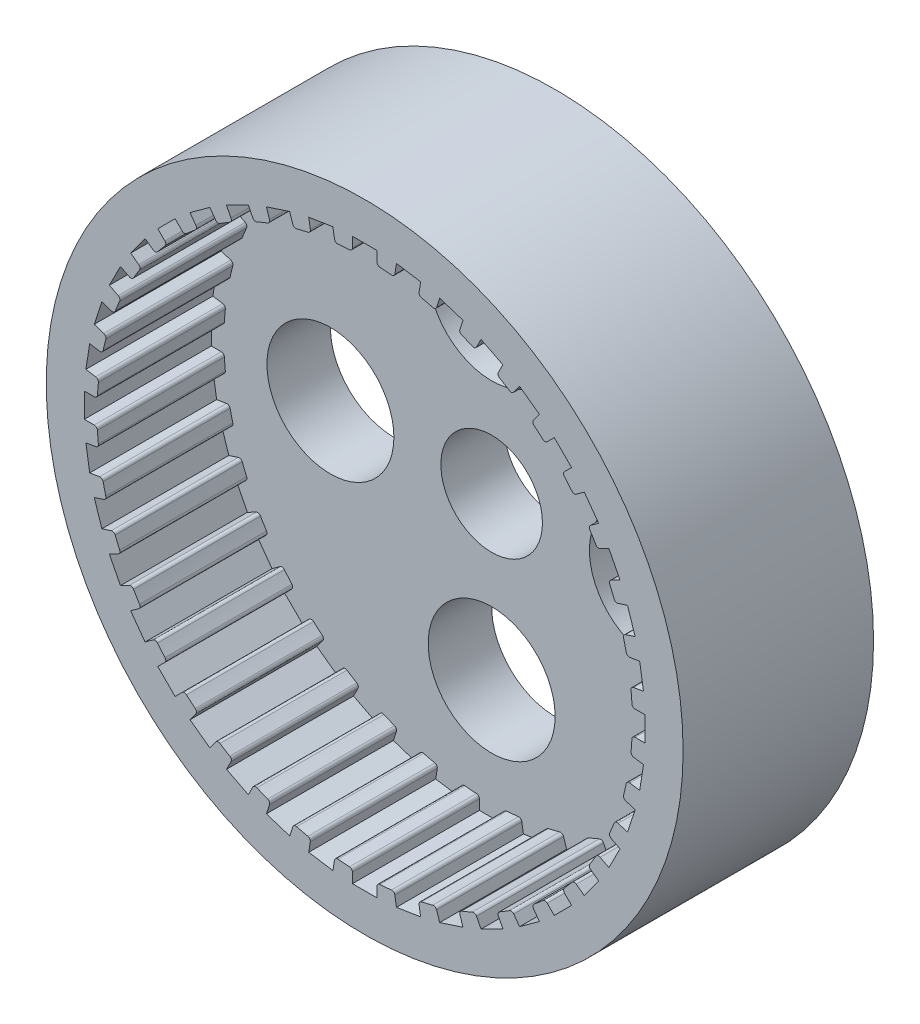
from build123d import *

# Parameters (mm, degrees)
SKETCH2_R                = 25.082
BOSS_EXTRUDE1_DEPTH      = 5
BOSS_EXTRUDE3_START      = 10
SKETCH4_R                = 25.082
SKETCH4_R_2              = 21.082
BOSS_EXTRUDE3_DEPTH      = 10
CUT_EXTRUDE1_REACH       = 38.854
SKETCH3_W                = 1.928241882
SKETCH3_H                = 1.022057103
FILLET1_R                = 0.25
CIRPATTERN1_COUNT        = 40
FILLET1_OF_CIRPATTERN1_R = 0.25
SKETCH6_R                = 5
CUT_EXTRUDE2_DEPTH       = 39.512510279
CIRPATTERN2_COUNT        = 4
CUT_EXTRUDE3_DEPTH       = 39.512510279
CUT_EXTRUDE3_DEPTH_BACK  = 39.512510279
SKETCH7_R                = 4


with BuildPart() as part:
    # Sketch2 → Boss-Extrude1 (new body)
    with BuildSketch(Plane.XY):
        Circle(SKETCH2_R)
    extrude(amount=-BOSS_EXTRUDE1_DEPTH)

    # Sketch4 → Boss-Extrude3 (add)
    with BuildSketch(Plane.XY.offset(BOSS_EXTRUDE3_START)):
        Circle(SKETCH4_R)
        Circle(SKETCH4_R_2, mode=Mode.SUBTRACT)
    extrude(amount=-BOSS_EXTRUDE3_DEPTH)

    # Sketch3 → Cut-Extrude1 (cut, up to next)
    with BuildSketch(Plane.XY, mode=Mode.PRIVATE) as cut_extrude1_sk1:
        with Locations((0, 21.570971449)):
            Rectangle(SKETCH3_W, SKETCH3_H)
    cut_extrude1_tool1 = extrude(cut_extrude1_sk1.sketch, amount=CUT_EXTRUDE1_REACH, mode=Mode.PRIVATE) & part.part
    cut_extrude1 = cut_extrude1_tool1.solids().sort_by_distance((0, 21.570971, 0))[0]
    add(cut_extrude1, mode=Mode.SUBTRACT)

    # Fillet1
    fillet1_edges = [part.edges().sort_by_distance(p)[0] for p in [
        (-0.964120941, 21.059942897, 5),
        (0.964120941, 21.059942897, 5),
    ]]
    fillet(fillet1_edges, radius=FILLET1_R)

    # CirPattern1: Cut-Extrude1 ×40 about axis
    cirpattern1_axis = Axis((0, 0, 0), (0, 0, 1))
    for i in range(1, CIRPATTERN1_COUNT):
        add(cut_extrude1.rotate(cirpattern1_axis, i * 360 / CIRPATTERN1_COUNT), mode=Mode.SUBTRACT)

    # Fillet1 of CirPattern1
    fillet1_of_cirpattern1_edges = [part.edges().sort_by_distance(p)[0] for p in [
        (-4.246751913, 20.649838309, 5),
        (-2.342249888, 20.951481796, 5),
        (-7.424813759, 19.731266169, 5),
        (-5.590946752, 20.32712568, 5),
        (-10.420052049, 18.326844772, 5),
        (-8.701975951, 19.202248268, 5),
        (-13.158714075, 16.471155633, 5),
        (-11.598733623, 17.604547775, 5),
        (-15.573364889, 14.209891978, 5),
        (-14.209891978, 15.573364889, 5),
        (-17.604547775, 11.598733623, 5),
        (-16.471155633, 13.158714075, 5),
        (-19.202248268, 8.701975951, 5),
        (-18.326844772, 10.420052049, 5),
        (-20.32712568, 5.590946752, 5),
        (-19.731266169, 7.424813759, 5),
        (-20.951481796, 2.342249888, 5),
        (-20.649838309, 4.246751913, 5),
        (-21.059942897, -0.964120941, 5),
        (-21.059942897, 0.964120941, 5),
        (-20.649838309, -4.246751913, 5),
        (-20.951481796, -2.342249888, 5),
        (-19.731266169, -7.424813759, 5),
        (-20.32712568, -5.590946752, 5),
        (-18.326844772, -10.420052049, 5),
        (-19.202248268, -8.701975951, 5),
        (-16.471155633, -13.158714075, 5),
        (-17.604547775, -11.598733623, 5),
        (-14.209891978, -15.573364889, 5),
        (-15.573364889, -14.209891978, 5),
        (-11.598733623, -17.604547775, 5),
        (-13.158714075, -16.471155633, 5),
        (-8.701975951, -19.202248268, 5),
        (-10.420052049, -18.326844772, 5),
        (-5.590946752, -20.32712568, 5),
        (-7.424813759, -19.731266169, 5),
        (-2.342249888, -20.951481796, 5),
        (-4.246751913, -20.649838309, 5),
        (0.964120941, -21.059942897, 5),
        (-0.964120941, -21.059942897, 5),
        (4.246751913, -20.649838309, 5),
        (2.342249888, -20.951481796, 5),
        (7.424813759, -19.731266169, 5),
        (5.590946752, -20.32712568, 5),
        (10.420052049, -18.326844772, 5),
        (8.701975951, -19.202248268, 5),
        (13.158714075, -16.471155633, 5),
        (11.598733623, -17.604547775, 5),
        (15.573364889, -14.209891978, 5),
        (14.209891978, -15.573364889, 5),
        (17.604547775, -11.598733623, 5),
        (16.471155633, -13.158714075, 5),
        (19.202248268, -8.701975951, 5),
        (18.326844772, -10.420052049, 5),
        (20.32712568, -5.590946752, 5),
        (19.731266169, -7.424813759, 5),
        (20.951481796, -2.342249888, 5),
        (20.649838309, -4.246751913, 5),
        (21.059942897, 0.964120941, 5),
        (21.059942897, -0.964120941, 5),
        (20.649838309, 4.246751913, 5),
        (20.951481796, 2.342249888, 5),
        (19.731266169, 7.424813759, 5),
        (20.32712568, 5.590946752, 5),
        (18.326844772, 10.420052049, 5),
        (19.202248268, 8.701975951, 5),
        (16.471155633, 13.158714075, 5),
        (17.604547775, 11.598733623, 5),
        (14.209891978, 15.573364889, 5),
        (15.573364889, 14.209891978, 5),
        (11.598733623, 17.604547775, 5),
        (13.158714075, 16.471155633, 5),
        (8.701975951, 19.202248268, 5),
        (10.420052049, 18.326844772, 5),
        (5.590946752, 20.32712568, 5),
        (7.424813759, 19.731266169, 5),
        (2.342249888, 20.951481796, 5),
        (4.246751913, 20.649838309, 5),
    ]]
    fillet(fillet1_of_cirpattern1_edges, radius=FILLET1_OF_CIRPATTERN1_R)

    # Sketch6 → Cut-Extrude2 (cut, symmetric)
    with BuildSketch(Plane(origin=(0, 0, -5), x_dir=(-1, 0, 0), z_dir=(0, 0, -1))):
        with Locations(Location((0, 12.7, 0), (0, 0, 180))):
            Circle(SKETCH6_R)
    cut_extrude2 = extrude(amount=CUT_EXTRUDE2_DEPTH, both=True, mode=Mode.SUBTRACT)

    # CirPattern2: Cut-Extrude2 ×4 about axis
    cirpattern2_axis = Axis((0, 0, 0), (0, 0, 1))
    for i in range(1, CIRPATTERN2_COUNT):
        add(cut_extrude2.rotate(cirpattern2_axis, i * 360 / CIRPATTERN2_COUNT), mode=Mode.SUBTRACT)

    # Sketch7 → Cut-Extrude3 (cut, two sides: drawn at the far end of the back side and taken through both)
    with BuildSketch(Plane(origin=(0, 0, -5), x_dir=(-1, 0, 0), z_dir=(0, 0, -1)).offset(-CUT_EXTRUDE3_DEPTH_BACK)):
        with Locations(Location((0, 0, 0), (0, 0, 180))):
            Circle(SKETCH7_R)
    extrude(amount=CUT_EXTRUDE3_DEPTH + CUT_EXTRUDE3_DEPTH_BACK, mode=Mode.SUBTRACT)


solid = part.part
